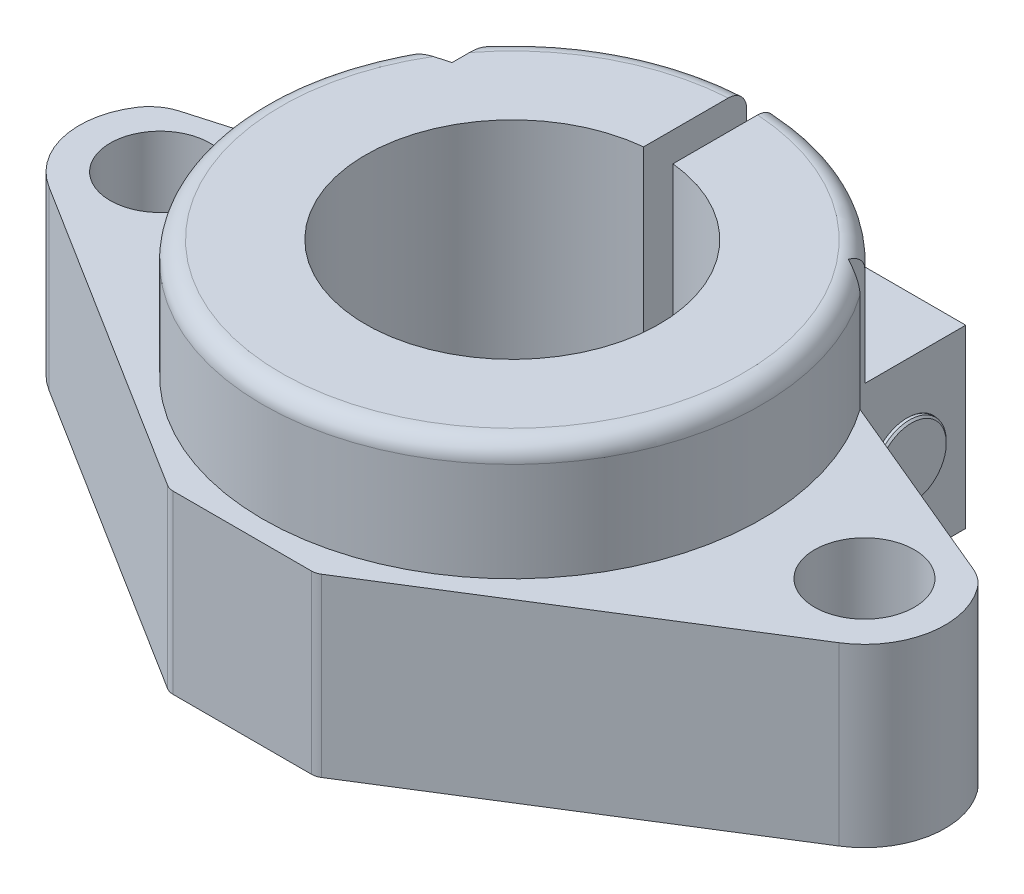
from build123d import *

# Parameters (mm, degrees)
SKETCH1_R                   = 3.4
BOSS_EXTRUDE1_DEPTH         = 12
SKETCH3_R                   = 17
BOSS_EXTRUDE2_DEPTH         = 8
FILLET1_R                   = 1.25
CUT_EXTRUDE1_DEPTH          = 37.78056552
CUT_EXTRUDE1_DEPTH_BACK     = 37.78056552
CUT_EXTRUDE2_DEPTH          = 41.109973918
CUT_EXTRUDE2_DEPTH_BACK     = 41.109973918
SKETCH4_R                   = 10
CUT_EXTRUDE3_DEPTH          = 41.109973918
CUT_EXTRUDE3_DEPTH_BACK     = 41.109973918
SKETCH5_W                   = 2
SKETCH5_H                   = 20
SKETCH7_R                   = 3
CUT_EXTRUDE4_DEPTH          = 12.5
FILLET2_R                   = 3
FILLET3_R                   = 1
M5_TAPPED_HOLE2_D           = 4.2
M5_TAPPED_HOLE2_CSINK_D     = 5.05
M5_TAPPED_HOLE2_CSINK_ANGLE = 90
BOSS_EXTRUDE4_DEPTH         = 0.001
BOSS_EXTRUDE4_DEPTH_BACK    = 25.5
SKETCH26_R                  = 2.5
SKETCH28_R                  = 4
BOSS_EXTRUDE5_DEPTH         = 5
CHAMFER1_SIZE               = 0.125
CUT_EXTRUDE5_DEPTH          = 3
FILLET4_R                   = 0.75


with BuildPart() as part:
    # Sketch1 → Boss-Extrude1 (new body)
    with BuildSketch(Plane(origin=(0, 0, 0), x_dir=(1, 0, 0), z_dir=(0, 1, 0))):
        with BuildLine():
            Line((5, -18.4), (-5, -18.4))
            Line((-5, -18.4), (-26.920975839, -4.66024679))
            ThreePointArc((-26.920975839, -4.66024679), (-29.473599119, -0.538249647), (-27.772784233, 4.002011885))
            Line((-27.772784233, 4.002011885), (-12.5, 18.4))
            Line((-12.5, 18.4), (12.5, 18.4))
            Line((12.5, 18.4), (27.772784233, 4.002011885))
            ThreePointArc((27.772784233, 4.002011885), (29.473599119, -0.538249647), (26.920975839, -4.66024679))
            Line((26.920975839, -4.66024679), (5, -18.4))
        make_face()
        with Locations(Location((-24, 0, 0), (0, 0, 270))):
            Circle(SKETCH1_R, mode=Mode.SUBTRACT)
        with Locations(Location((24, 0, 0), (0, 0, 90))):
            Circle(SKETCH1_R, mode=Mode.SUBTRACT)
    extrude(amount=BOSS_EXTRUDE1_DEPTH)

    # Sketch3 → Boss-Extrude2 (add)
    with BuildSketch(Plane(origin=(0, 12, 0), x_dir=(1, 0, 0), z_dir=(0, 1, 0))):
        with Locations(Location((0, 0, 0), (0, 0, 270))):
            Circle(SKETCH3_R)
    extrude(amount=BOSS_EXTRUDE2_DEPTH)

    # Fillet1
    fillet1_edges = [part.edges().sort_by_distance(p)[0] for p in [
        (0, 20, -17),
    ]]
    fillet(fillet1_edges, radius=FILLET1_R)

    # Sketch2 → Cut-Extrude1 (cut, two sides: drawn at the far end of the back side and taken through both)
    with BuildSketch(Plane(origin=(0, 12, 0), x_dir=(1, 0, 0), z_dir=(0, 1, 0)).offset(-CUT_EXTRUDE1_DEPTH_BACK)):
        Polygon((12.5, 18.4), (12.5, 10.4), (27.772784233, 4.002011885), align=None)
        Polygon((-12.5, 18.4), (-12.5, 8.399645995), (-27.772784233, 4.002011885), align=None)
    extrude(amount=CUT_EXTRUDE1_DEPTH + CUT_EXTRUDE1_DEPTH_BACK, mode=Mode.SUBTRACT)

    # Sketch4 → Cut-Extrude2 (cut, two sides: drawn at the far end of the back side and taken through both)
    with BuildSketch(Plane(origin=(0, 20, 0), x_dir=(1, 0, 0), z_dir=(0, 1, 0)).offset(-CUT_EXTRUDE2_DEPTH_BACK)):
        with Locations(Location((0, 0, 0), (0, 0, 270))):
            Circle(SKETCH4_R)
    extrude(amount=CUT_EXTRUDE2_DEPTH + CUT_EXTRUDE2_DEPTH_BACK, mode=Mode.SUBTRACT)

    # Sketch5 → Cut-Extrude3 (cut, two sides: drawn at the far end of the back side and taken through both)
    with BuildSketch(Plane(origin=(0, 20, 0), x_dir=(1, 0, 0), z_dir=(0, 1, 0)).offset(-CUT_EXTRUDE3_DEPTH_BACK)):
        with Locations((0, 10)):
            Rectangle(SKETCH5_W, SKETCH5_H)
    extrude(amount=CUT_EXTRUDE3_DEPTH + CUT_EXTRUDE3_DEPTH_BACK, mode=Mode.SUBTRACT)

    # Sketch7 → Cut-Extrude4 (cut)
    with BuildSketch(Plane.ZY.offset(12.5)):
        with Locations((-14.4, 6)):
            Circle(SKETCH7_R)
    extrude(amount=-CUT_EXTRUDE4_DEPTH, mode=Mode.SUBTRACT)

    # Fillet2
    fillet2_edges = [part.edges().sort_by_distance(p)[0] for p in [
        (27.772784233, 6, -4.002011885),
        (-27.772784233, 6, -4.002011885),
    ]]
    fillet(fillet2_edges, radius=FILLET2_R)

    # Fillet3
    fillet3_edges = [part.edges().sort_by_distance(p)[0] for p in [
        (5, 6, 18.4),
        (-5, 6, 18.4),
    ]]
    fillet(fillet3_edges, radius=FILLET3_R)

    # M5 Tapped Hole2 (through all)
    with Locations(Plane(origin=(12.5, 0, 0), x_dir=(0, 0, -1), z_dir=(1, 0, 0))):
        with Locations((14.4, 6)):
            CounterSinkHole(M5_TAPPED_HOLE2_D / 2, M5_TAPPED_HOLE2_CSINK_D / 2, counter_sink_angle=M5_TAPPED_HOLE2_CSINK_ANGLE)



with BuildPart() as body_2:
    # Sketch26 → Boss-Extrude4 (new, two sides: drawn at the far end of the back side and taken through both)
    with BuildSketch(Plane.ZY.offset(12.7).offset(-BOSS_EXTRUDE4_DEPTH_BACK)):
        with Locations((-14.4, 6)):
            Circle(SKETCH26_R)
    extrude(amount=BOSS_EXTRUDE4_DEPTH + BOSS_EXTRUDE4_DEPTH_BACK)


with BuildPart() as part_1:
    add(part.part)

    add(body_2.part)  # Boss-Extrude5 merges body 2
    # Sketch28 → Boss-Extrude5 (add)
    with BuildSketch(Plane.ZY.offset(12.701)):
        with Locations((-14.4, 6)):
            Circle(SKETCH28_R)
    extrude(amount=BOSS_EXTRUDE5_DEPTH)

    # Chamfer1
    chamfer1_edges = [part_1.edges().sort_by_distance(p)[0] for p in [
        (12.8, 6, -16.9),
    ]]
    chamfer(chamfer1_edges, length=CHAMFER1_SIZE)

    # Sketch29 → Cut-Extrude5 (cut)
    with BuildSketch(Plane.ZY.offset(17.701)):
        Polygon((-15.067828808, 8.570474279), (-16.960010429, 6.706880427), (-16.292181621, 4.136406148), (-13.732171192, 3.429525721), (-11.839989571, 5.293119573), (-12.507818379, 7.863593852), align=None)
    extrude(amount=-CUT_EXTRUDE5_DEPTH, mode=Mode.SUBTRACT)

    # Fillet4
    fillet4_edges = [part_1.edges().sort_by_distance(p)[0] for p in [
        (-17.701, 6, -18.4),
    ]]
    fillet(fillet4_edges, radius=FILLET4_R)


solid = part_1.part
